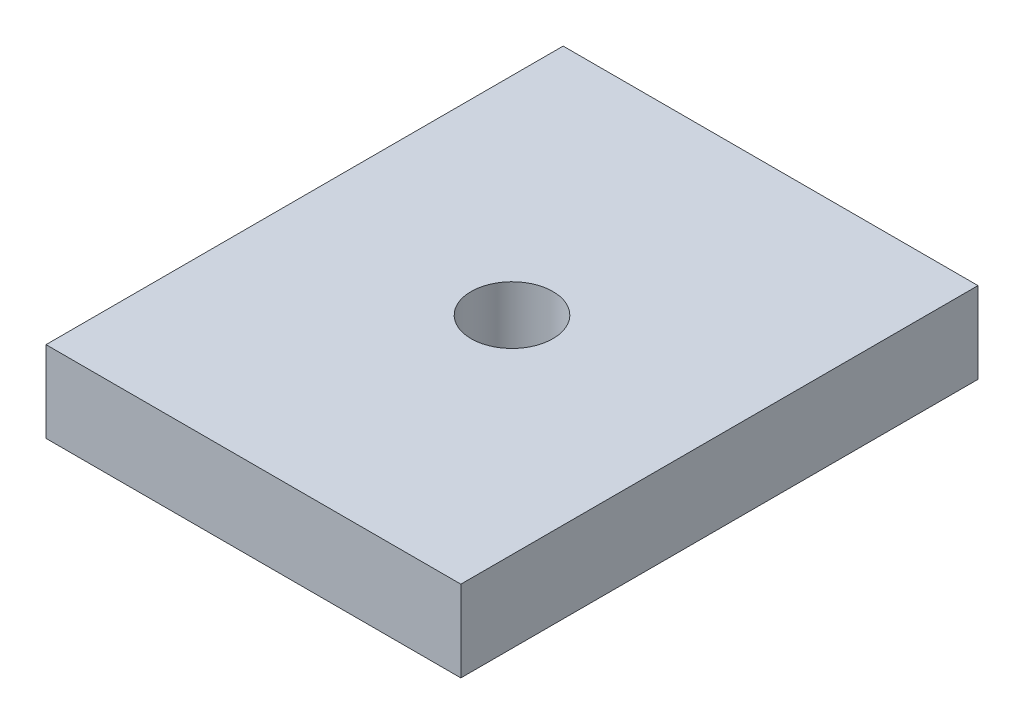
from build123d import *

# Parameters (mm, degrees)
SKETCH1_W           = 51.075859404
SKETCH1_H           = 63.669825848
BOSS_EXTRUDE1_DEPTH = 10
SKETCH2_R           = 5.03656923
CUT_EXTRUDE1_DEPTH  = 10


with BuildPart() as part:
    # Sketch1 → Boss-Extrude1 (new body)
    with BuildSketch(Plane(origin=(0, 0, 0), x_dir=(1, 0, 0), z_dir=(0, 1, 0))):
        Rectangle(SKETCH1_W, SKETCH1_H)
    extrude(amount=BOSS_EXTRUDE1_DEPTH)

    # Sketch2 → Cut-Extrude1 (cut)
    with BuildSketch(Plane(origin=(0, 10, 0), x_dir=(1, 0, 0), z_dir=(0, 1, 0))):
        with Locations(Location((0, 0, 0), (0, 0, 270))):
            Circle(SKETCH2_R)
    extrude(amount=-CUT_EXTRUDE1_DEPTH, mode=Mode.SUBTRACT)


solid = part.part
